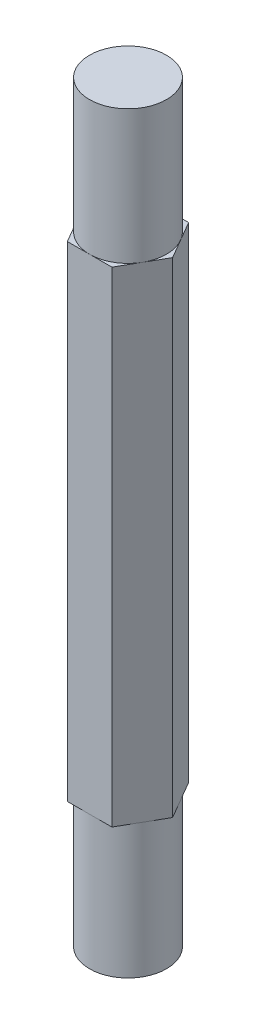
from build123d import *

# Parameters (mm, degrees)
BOSS_EXTRUDE1_DEPTH = 40.005
SKETCH2_R           = 3.175
BOSS_EXTRUDE2_DEPTH = 11.049
BOSS_EXTRUDE3_START = 11.049
SKETCH3_R           = 3.175
BOSS_EXTRUDE3_DEPTH = 11.049


with BuildPart() as part:
    # Sketch1 → Boss-Extrude1 (new body)
    with BuildSketch(Plane(origin=(0, 0, 0), x_dir=(1, 0, 0), z_dir=(0, 1, 0))):
        Polygon((1.820388385, 3.182297827), (-1.845756569, 3.1676515), (-3.666144953, -0.014646328), (-1.820388385, -3.182297827), (1.845756569, -3.1676515), (3.666144953, 0.014646328), align=None)
    extrude(amount=BOSS_EXTRUDE1_DEPTH)

    # Sketch2 → Boss-Extrude2 (add)
    with BuildSketch(Plane(origin=(0, 40.005, 0), x_dir=(1, 0, 0), z_dir=(0, 1, 0))):
        with Locations(Location((0, 0, 0), (0, 0, 90.228896653))):
            Circle(SKETCH2_R)
    extrude(amount=BOSS_EXTRUDE2_DEPTH)

    # Sketch3 → Boss-Extrude3 (add)
    with BuildSketch(Plane(origin=(0, 0, 0), x_dir=(-1, 0, 0), z_dir=(0, -1, 0)).offset(BOSS_EXTRUDE3_START)):
        with Locations(Location((0, 0, 0), (0, 0, 89.771103347))):
            Circle(SKETCH3_R)
    extrude(amount=-BOSS_EXTRUDE3_DEPTH)


solid = part.part
